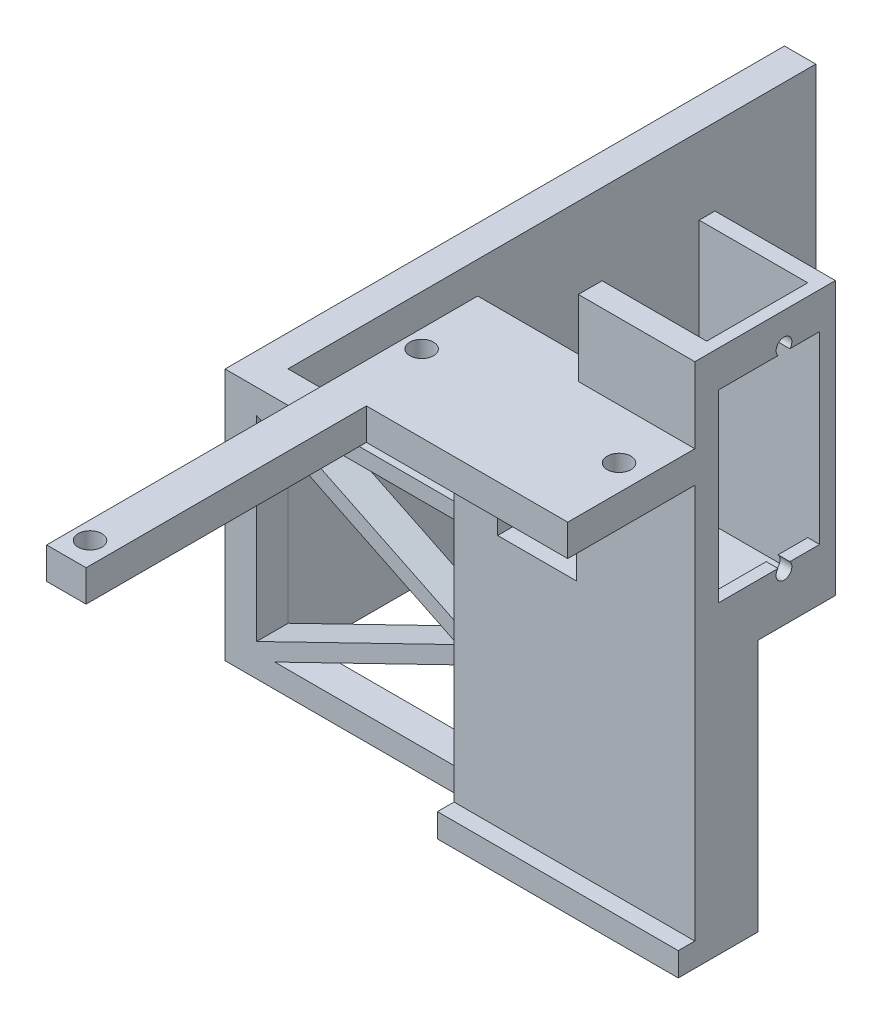
from build123d import *

# Parameters (mm, degrees)
SKETCH1_W            = 25.5
SKETCH1_H            = 14
BOSS_EXTRUDE1_DEPTH  = 4
SKETCH2_R            = 1.5
CUT_EXTRUDE1_DEPTH   = 53.71750714
SKETCH3_W            = 30.5
SKETCH3_H            = 4
BOSS_EXTRUDE2_DEPTH  = 5.1
SKETCH4_W            = 30.5
SKETCH4_H            = 3
BOSS_EXTRUDE3_DEPTH  = 21
SKETCH5_W            = 30.5
SKETCH5_H            = 2
BOSS_EXTRUDE8_DEPTH  = 14.8
SKETCH10_W           = 30.5
SKETCH10_H           = 2
BOSS_EXTRUDE9_DEPTH  = 16.8
SKETCH11_W           = 1.5
SKETCH11_H           = 12.8
BOSS_EXTRUDE10_DEPTH = 4.6
SKETCH13_W           = 15.25
SKETCH13_H           = 2
BOSS_EXTRUDE11_DEPTH = 15.75
SKETCH14_W           = 10
SKETCH14_H           = 5
CUT_EXTRUDE5_DEPTH   = 3
SKETCH16_R           = 1
CUT_EXTRUDE6_DEPTH   = 10
SKETCH15_W           = 14.75
SKETCH15_H           = 3
BOSS_EXTRUDE12_DEPTH = 9.55
SKETCH18_W           = 30.5
SKETCH18_H           = 4
BOSS_EXTRUDE13_DEPTH = 32
SKETCH19_W           = 30.5
SKETCH19_H           = 3
BOSS_EXTRUDE14_DEPTH = 2.1
BOSS_EXTRUDE17_DEPTH = 4
SKETCH24_W           = 3.969230492
SKETCH24_H           = 32
BOSS_EXTRUDE18_DEPTH = 66.85


with BuildPart() as part:
    # Sketch1 → Boss-Extrude1 (new body)
    with BuildSketch(Plane(origin=(0, 0, 0), x_dir=(1, 0, 0), z_dir=(0, 1, 0))):
        Polygon((-36.234375, 16.8984375), (-41.234375, 16.8984375), (-41.234375, -32.6015625), (-36.234375, -32.6015625), (-36.234375, 2.8984375), align=None)
        with Locations((-23.484375, 9.8984375)):
            Rectangle(SKETCH1_W, SKETCH1_H)
    extrude(amount=BOSS_EXTRUDE1_DEPTH)

    # Sketch2 → Cut-Extrude1 (cut, through all)
    with BuildSketch(Plane(origin=(0, 4, 0), x_dir=(1, 0, 0), z_dir=(0, 1, 0))):
        with Locations(Location((-38.984375, -29.3515625, 0), (0, 0, 270))):
            Circle(SKETCH2_R)
        with Locations(Location((-38.984375, 12.6484375, 0), (0, 0, 270))):
            Circle(SKETCH2_R)
        with Locations(Location((-13.984375, 12.6484375, 0), (0, 0, 270))):
            Circle(SKETCH2_R)
    extrude(amount=-CUT_EXTRUDE1_DEPTH, mode=Mode.SUBTRACT)

    # Sketch3 → Boss-Extrude2 (add)
    with BuildSketch(Plane(origin=(0, 0, -16.8984375), x_dir=(-1, 0, 0), z_dir=(0, 0, -1))):
        with Locations((25.984375, 2)):
            Rectangle(SKETCH3_W, SKETCH3_H)
    extrude(amount=BOSS_EXTRUDE2_DEPTH)

    # Sketch4 → Boss-Extrude3 (add)
    with BuildSketch(Plane.XZ):
        with Locations((-25.984375, -20.4984375)):
            Rectangle(SKETCH4_W, SKETCH4_H)
    extrude(amount=BOSS_EXTRUDE3_DEPTH)

    # Sketch5 → Boss-Extrude8 (add)
    with BuildSketch(Plane(origin=(0, 0, -21.9984375), x_dir=(-1, 0, 0), z_dir=(0, 0, -1))):
        with Locations((25.984375, -20)):
            Rectangle(SKETCH5_W, SKETCH5_H)
    extrude(amount=BOSS_EXTRUDE8_DEPTH)

    # Sketch10 → Boss-Extrude9 (add)
    with BuildSketch(Plane(origin=(0, -19, 0), x_dir=(1, 0, 0), z_dir=(0, 1, 0))):
        with Locations((-25.984375, 35.7984375)):
            Rectangle(SKETCH10_W, SKETCH10_H)
    extrude(amount=BOSS_EXTRUDE9_DEPTH)

    # Sketch11 → Boss-Extrude10 (add)
    with BuildSketch(Plane(origin=(0, -19, 0), x_dir=(1, 0, 0), z_dir=(0, 1, 0))):
        with Locations((-11.484375, 28.3984375)):
            Rectangle(SKETCH11_W, SKETCH11_H)
    boss_extrude10 = extrude(amount=BOSS_EXTRUDE10_DEPTH)

    # Sketch13 → Boss-Extrude11 (add)
    with BuildSketch(Plane(origin=(0, -2.2, 0), x_dir=(1, 0, 0), z_dir=(0, 1, 0))):
        with Locations((-18.359375, 35.7984375)):
            Rectangle(SKETCH13_W, SKETCH13_H)
    extrude(amount=BOSS_EXTRUDE11_DEPTH)

    # Sketch14 → Cut-Extrude5 (cut)
    with BuildSketch(Plane.XY.offset(-18.9984375)):
        with Locations((-30.706752917, -15.5)):
            Rectangle(SKETCH14_W, SKETCH14_H)
    extrude(amount=-CUT_EXTRUDE5_DEPTH, mode=Mode.SUBTRACT)

    # Sketch16 → Cut-Extrude6 (cut)
    with BuildSketch(Plane(origin=(-10.734375, 0, 0), x_dir=(0, 0, -1), z_dir=(1, 0, 0))):
        with Locations((30.286455297, -15.059839978)):
            Circle(SKETCH16_R)
    cut_extrude6 = extrude(amount=-CUT_EXTRUDE6_DEPTH, mode=Mode.SUBTRACT)

    # Mirror1: Boss-Extrude10, Cut-Extrude6 across plane
    add(boss_extrude10.mirror(Plane(origin=(0, -2.725, 0), x_dir=(0, 0, 1), z_dir=(0, -1, 0))))
    add(cut_extrude6.mirror(Plane(origin=(0, -2.725, 0), x_dir=(0, 0, 1), z_dir=(0, -1, 0))), mode=Mode.SUBTRACT)

    # Sketch15 → Boss-Extrude12 (add)
    with BuildSketch(Plane(origin=(0, 4, 0), x_dir=(1, 0, 0), z_dir=(0, 1, 0))):
        with Locations((-18.109375, 20.4984375)):
            Rectangle(SKETCH15_W, SKETCH15_H)
    extrude(amount=BOSS_EXTRUDE12_DEPTH)

    # Sketch18 → Boss-Extrude13 (add)
    with BuildSketch(Plane.XZ.offset(21)):
        with Locations((-25.984375, -20.9984375)):
            Rectangle(SKETCH18_W, SKETCH18_H)
    extrude(amount=BOSS_EXTRUDE13_DEPTH)

    # Sketch19 → Boss-Extrude14 (add)
    with BuildSketch(Plane.XY.offset(-18.9984375)):
        with Locations((-25.984375, -51.5)):
            Rectangle(SKETCH19_W, SKETCH19_H)
    extrude(amount=BOSS_EXTRUDE14_DEPTH)

    # Sketch20 → Boss-Extrude17 (add)
    with BuildSketch(Plane(origin=(0, 0, -22.9984375), x_dir=(-1, 0, 0), z_dir=(0, 0, -1))):
        Polygon((14.734375, -24.112056249), (14.734375, -23), (17.020268401, -23), (41.234375, -23), (41.234375, -21), (10.734375, -21), (10.734375, -53), (41.234375, -53), (41.234375, -50), (17.020268401, -50), (14.734375, -50), (14.734375, -48.887943751), align=None)
        Polygon((41.234375, -21), (41.234375, -23), (67.948481599, -23), (70.234375, -23), (70.234375, -24.112056249), (70.234375, -48.887943751), (70.234375, -50), (67.948481599, -50), (41.234375, -50), (41.234375, -53), (74.234375, -53), (74.234375, -21), align=None)
        Polygon((17.020268401, -23), (14.734375, -23), (14.734375, -24.112056249), (40.198481599, -36.5), (14.734375, -48.887943751), (14.734375, -50), (17.020268401, -50), (41.234375, -38.220164357), (41.234375, -34.779835643), align=None)
        Polygon((42.484375, -35.387943751), (41.234375, -34.779835643), (41.234375, -38.220164357), (42.484375, -37.612056249), (67.948481599, -50), (70.234375, -50), (70.234375, -48.887943751), (44.770268401, -36.5), (70.234375, -24.112056249), (70.234375, -23), (67.948481599, -23), align=None)
    extrude(amount=BOSS_EXTRUDE17_DEPTH)

    # Sketch24 → Boss-Extrude18 (add)
    with BuildSketch(Plane(origin=(0, 0, -26.9984375), x_dir=(-1, 0, 0), z_dir=(0, 0, -1))):
        with Locations((72.249759754, -37)):
            Rectangle(SKETCH24_W, SKETCH24_H)
    extrude(amount=BOSS_EXTRUDE18_DEPTH)


solid = part.part
